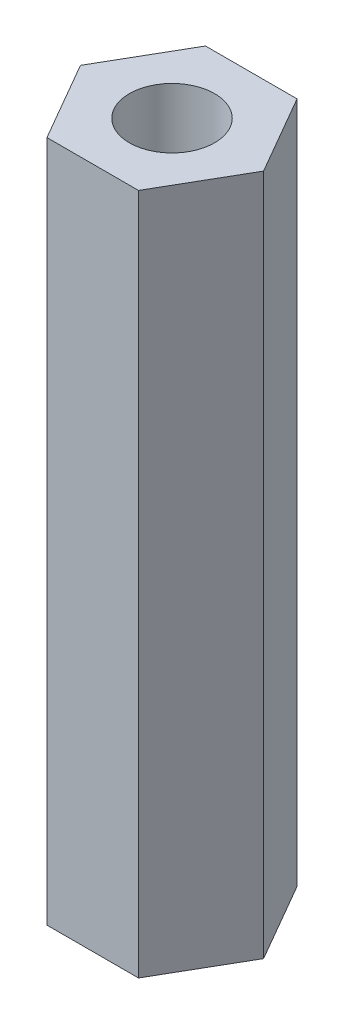
from build123d import *

# Parameters (mm, degrees)
EXTRUDE_1_DEPTH = 10


with BuildPart() as part:
    # 草图1 → 凸台-拉伸1 (new, symmetric)
    with BuildSketch(Plane(origin=(0, 0, 0), x_dir=(1, 0, 0), z_dir=(0, 1, 0))):
        Polygon((2.684678752, 0), (1.342339376, 2.325), (-1.342339376, 2.325), (-2.684678752, 0), (-1.342339376, -2.325), (1.342339376, -2.325), align=None)
    extrude(amount=EXTRUDE_1_DEPTH, both=True)

    # 草图2 → M3 螺纹孔1 (revolve, cut)
    with BuildSketch(Plane(origin=(0, -10, 0), x_dir=(0, 0, -1), z_dir=(1, 0, 0))):
        Polygon((0, 0), (0, 8.251075774), (1.25, 7.5), (1.25, 0), align=None)
    hole_wizard_m3_1 = revolve(axis=Axis((0, -16.35, 0), (0, 1, 0)), mode=Mode.SUBTRACT)

    # 镜向1: M3 螺纹孔1 across plane
    add(hole_wizard_m3_1.mirror(Plane.ZX), mode=Mode.SUBTRACT)


solid = part.part
